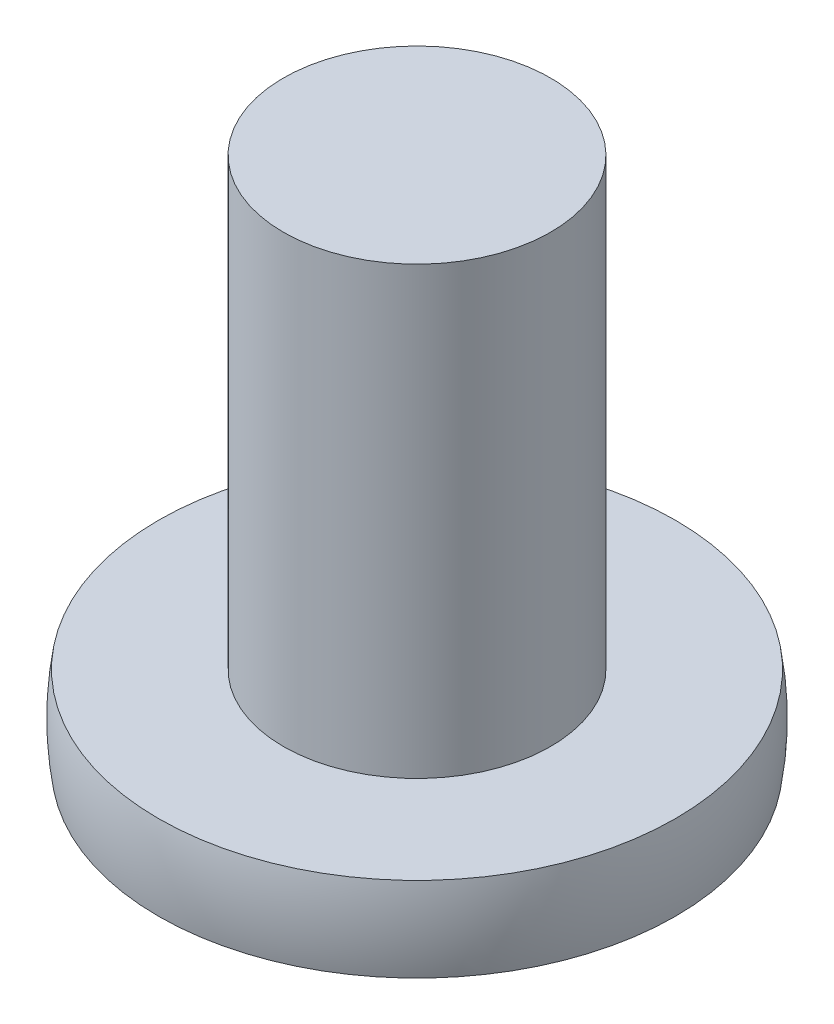
from build123d import *

# Parameters (mm, degrees)
SKETCH_1_R          = 1.5
EXTRUDE_1_DEPTH     = 2
SKETCH_2_R          = 2.95
EXTRUDE_2_DEPTH     = 0.95
CUT_EXTRUDE_1_DEPTH = 0.6
SKETCH_1_8_R        = 1.5
EXTRUDE_5_DEPTH     = 5


with BuildPart() as part:
    # 草图1 → 拉伸1 (new body)
    with BuildSketch(Plane(origin=(0, 0, 0), x_dir=(1, 0, 0), z_dir=(0, 1, 0))):
        Circle(SKETCH_1_R)
    extrude(amount=EXTRUDE_1_DEPTH)

    # 草图2 → Extrude 2 (add)
    with BuildSketch(Plane(origin=(0, 0, 0), x_dir=(-1, 0, 0), z_dir=(0, 1, 0))):
        Circle(SKETCH_2_R)
    extrude(amount=-EXTRUDE_2_DEPTH)

    # 草图4 → 切除-旋转1 (revolve, cut)
    with BuildSketch(Plane(origin=(0, 0, 0), x_dir=(0, 0, -1), z_dir=(1, 0, 0))):
        with BuildLine():
            Line((-2.901374674, 0), (-2.95, 0))
            Line((-2.95, 0), (-2.95, -0.95))
            Line((-2.95, -0.95), (-2.901374674, -0.95))
            ThreePointArc((-2.901374674, -0.95), (-2.94, -0.475), (-2.901374674, 0))
        make_face()
    revolve(axis=Axis((0, 3.165730861, 0), (0, -1, 0)), mode=Mode.SUBTRACT)

    # 草图3 → 切除-拉伸1 (cut)
    with BuildSketch(Plane.XZ.offset(0.95)):
        Polygon((1.5, -0.4), (1.5, 0.4), (0.4, 0.4), (0.4, 1.5), (-0.4, 1.5), (-0.4, 0.4), (-1.5, 0.4), (-1.5, -0.4), (-0.4, -0.4), (-0.4, -1.5), (0.4, -1.5), (0.4, -0.4), align=None)
    extrude(amount=-CUT_EXTRUDE_1_DEPTH, mode=Mode.SUBTRACT)

    # 草图1<8> → 凸台-拉伸5 (add)
    with BuildSketch(Plane(origin=(0, 0, 0), x_dir=(1, 0, 0), z_dir=(0, 1, 0))):
        Circle(SKETCH_1_8_R)
    extrude(amount=EXTRUDE_5_DEPTH)


solid = part.part
